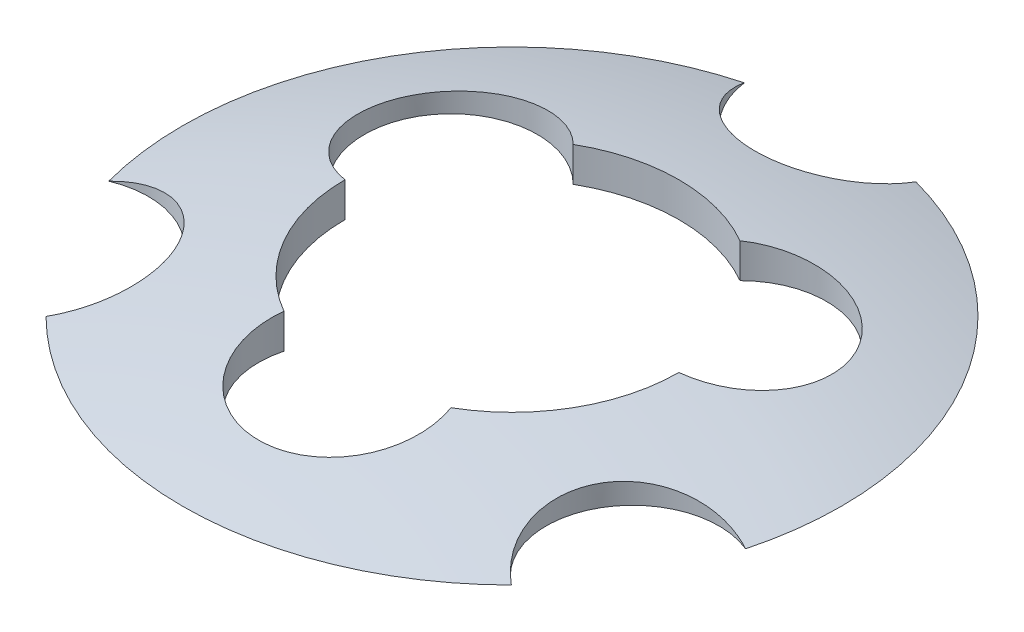
from build123d import *

# Parameters (mm, degrees)
CORTAR_EXTRUIR1_REACH = 15.507
CROQUIS2_R            = 2.5


with BuildPart() as part:
    # Croquis1 → Revolución1 (revolve)
    with BuildSketch(Plane.XY):
        with BuildLine():
            Line((0, 0), (9.525, 0))
            ThreePointArc((9.525, 0), (7.192400503, 0.581782366), (4.825, 1))
            Line((4.825, 1), (0, 1))
            Line((0, 1), (0, 0))
        make_face()
    revolve(axis=Axis((0, 0, 0), (0, 1, 0)))

    # Croquis2 → Cortar-Extruir1 (cut, up to next)
    with BuildSketch(Plane(origin=(0, 1, 0), x_dir=(1, 0, 0), z_dir=(0, 1, 0)), mode=Mode.PRIVATE) as cortar_extruir1_sk1:
        with Locations((0, 9.525)):
            Circle(CROQUIS2_R)
    cortar_extruir1_tool1 = extrude(cortar_extruir1_sk1.sketch, amount=-CORTAR_EXTRUIR1_REACH, mode=Mode.PRIVATE) & part.part
    # Croquis2 → Cortar-Extruir1 (cut, up to next)
    with BuildSketch(Plane(origin=(0, 1, 0), x_dir=(1, 0, 0), z_dir=(0, 1, 0)), mode=Mode.PRIVATE) as cortar_extruir1_sk2:
        with Locations((8.248891971, -4.7625)):
            Circle(CROQUIS2_R)
    cortar_extruir1_tool2 = extrude(cortar_extruir1_sk2.sketch, amount=-CORTAR_EXTRUIR1_REACH, mode=Mode.PRIVATE) & part.part
    # Croquis2 → Cortar-Extruir1 (cut, up to next)
    with BuildSketch(Plane(origin=(0, 1, 0), x_dir=(1, 0, 0), z_dir=(0, 1, 0)), mode=Mode.PRIVATE) as cortar_extruir1_sk3:
        with Locations((-8.248891971, -4.7625)):
            Circle(CROQUIS2_R)
    cortar_extruir1_tool3 = extrude(cortar_extruir1_sk3.sketch, amount=-CORTAR_EXTRUIR1_REACH, mode=Mode.PRIVATE) & part.part
    # Croquis2 → Cortar-Extruir1 (cut, up to next)
    with BuildSketch(Plane(origin=(0, 1, 0), x_dir=(1, 0, 0), z_dir=(0, 1, 0)), mode=Mode.PRIVATE) as cortar_extruir1_sk4:
        with BuildLine():
            ThreePointArc((-4.824999362, -0.002480829), (-4.178572573, -2.4125), (-2.414648142, -4.177331606))
            ThreePointArc((-2.414648142, -4.177331606), (0, -7.325), (2.414648142, -4.177331606))
            ThreePointArc((2.414648142, -4.177331606), (4.178572573, -2.4125), (4.824999362, -0.002480829))
            ThreePointArc((4.824999362, -0.002480829), (6.343636083, 3.6625), (2.41035122, 4.179812436))
            ThreePointArc((2.41035122, 4.179812436), (0, 4.825), (-2.41035122, 4.179812436))
            ThreePointArc((-2.41035122, 4.179812436), (-6.343636083, 3.6625), (-4.824999362, -0.002480829))
        make_face()
    cortar_extruir1_tool4 = extrude(cortar_extruir1_sk4.sketch, amount=-CORTAR_EXTRUIR1_REACH, mode=Mode.PRIVATE) & part.part
    add(cortar_extruir1_tool1.solids().sort_by_distance((0, 1, -9.525))[0], mode=Mode.SUBTRACT)
    add(cortar_extruir1_tool2.solids().sort_by_distance((8.248892, 1, 4.7625))[0], mode=Mode.SUBTRACT)
    add(cortar_extruir1_tool3.solids().sort_by_distance((-8.248892, 1, 4.7625))[0], mode=Mode.SUBTRACT)
    add(cortar_extruir1_tool4.solids().sort_by_distance((0, 1, 0))[0], mode=Mode.SUBTRACT)


solid = part.part
